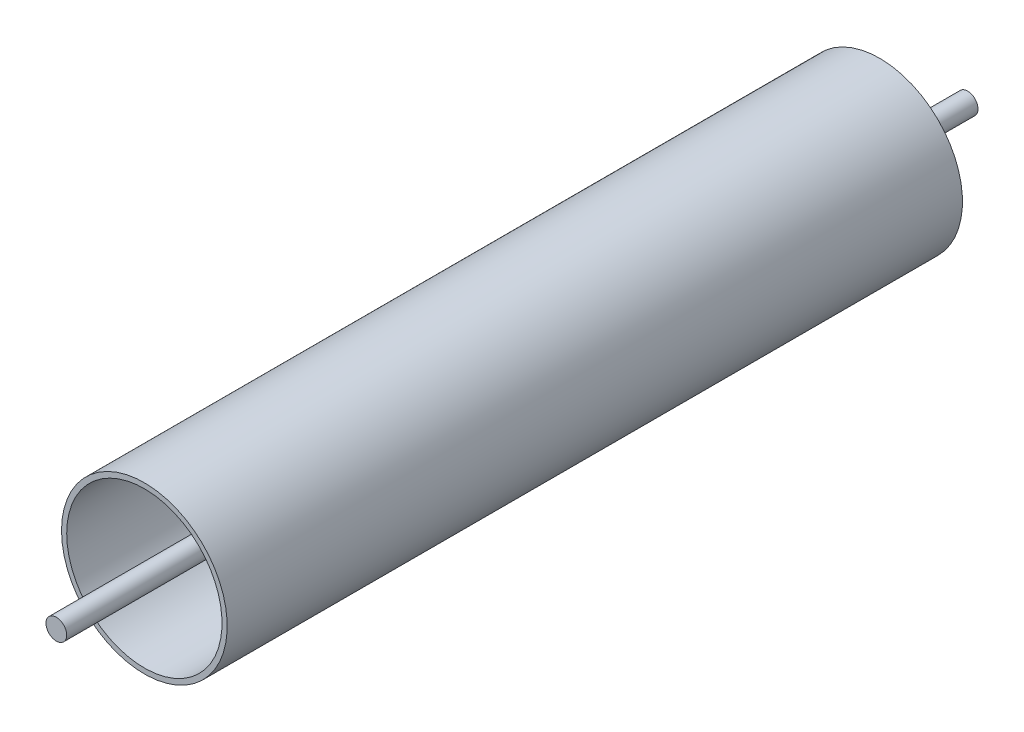
from build123d import *

# Parameters (mm, degrees)
SKETCH1_R           = 3.175
BOSS_EXTRUDE1_DEPTH = 139.7
SKETCH2_R           = 25.4
SKETCH2_R_2         = 23.8125
BOSS_EXTRUDE2_DEPTH = 112.7125


with BuildPart() as part:
    # Sketch1 → Boss-Extrude1 (new, symmetric)
    with BuildSketch(Plane.XY):
        Circle(SKETCH1_R)
    extrude(amount=BOSS_EXTRUDE1_DEPTH, both=True)


with BuildPart() as body_2:
    # Sketch2 → Boss-Extrude2 (new, symmetric)
    with BuildSketch(Plane.XY):
        with Locations(Location((0, 0, 0), (0, 0, 180))):
            Circle(SKETCH2_R)
        with Locations(Location((0, 0, 0), (0, 0, 180))):
            Circle(SKETCH2_R_2, mode=Mode.SUBTRACT)
    extrude(amount=BOSS_EXTRUDE2_DEPTH, both=True)


solid = Compound([part.part, body_2.part])
